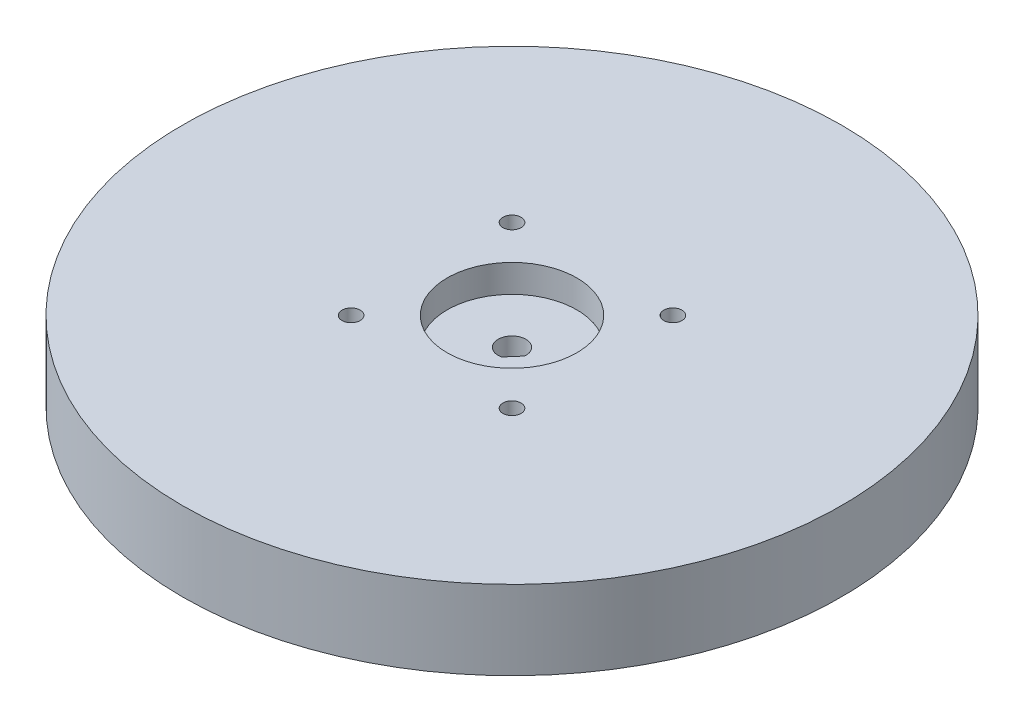
from build123d import *

# Parameters (mm, degrees)
SKETCH2_R           = 63.5
BOSS_EXTRUDE1_DEPTH = 15.24
CUT_EXTRUDE3_DEPTH  = 92.086539071
SKETCH4_R           = 1.75
CUT_EXTRUDE4_DEPTH  = 55.626
SKETCH5_R           = 12.5
CUT_EXTRUDE5_DEPTH  = 5.334


with BuildPart() as part:
    # Sketch2 → Boss-Extrude1 (new body)
    with BuildSketch(Plane(origin=(0, 0, 0), x_dir=(1, 0, 0), z_dir=(0, 1, 0))):
        Circle(SKETCH2_R)
    extrude(amount=BOSS_EXTRUDE1_DEPTH)

    # Sketch3 → Cut-Extrude3 (cut, through all)
    with BuildSketch(Plane(origin=(0, 15.24, 0), x_dir=(1, 0, 0), z_dir=(0, 1, 0))):
        with BuildLine():
            ThreePointArc((2.683094535, 0), (-2.104641397, 1.664175734), (0.618701471, -2.610786237))
            Line((0.618701471, -2.610786237), (2.670795382, -0.25660926))
            ThreePointArc((2.670795382, -0.25660926), (2.680017983, -0.128451918), (2.683094535, 0))
        make_face()
    extrude(amount=-CUT_EXTRUDE3_DEPTH, mode=Mode.SUBTRACT)

    # Sketch4 → Cut-Extrude4 (cut)
    with BuildSketch(Plane(origin=(0, 15.24, 0), x_dir=(1, 0, 0), z_dir=(0, 1, 0))):
        with Locations((-15.5, 15.5)):
            Circle(SKETCH4_R)
        with Locations((15.5, 15.5)):
            Circle(SKETCH4_R)
        with Locations((15.5, -15.5)):
            Circle(SKETCH4_R)
        with Locations((-15.5, -15.5)):
            Circle(SKETCH4_R)
    extrude(amount=-CUT_EXTRUDE4_DEPTH, mode=Mode.SUBTRACT)

    # Sketch5 → Cut-Extrude5 (cut)
    with BuildSketch(Plane(origin=(0, 15.24, 0), x_dir=(1, 0, 0), z_dir=(0, 1, 0))):
        Circle(SKETCH5_R)
    extrude(amount=-CUT_EXTRUDE5_DEPTH, mode=Mode.SUBTRACT)


solid = part.part
